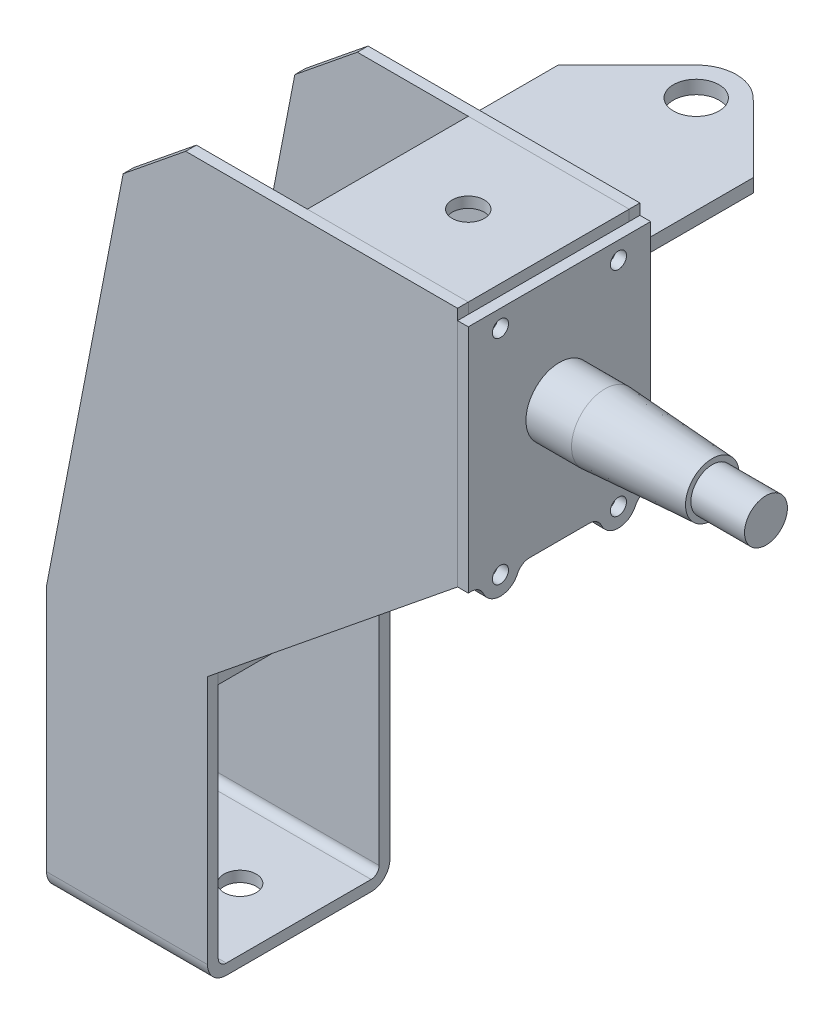
from build123d import *

# Parameters (mm, degrees)
BOSS_EXTRUDE2_DEPTH  = 107
CUT_EXTRUDE1_DEPTH   = 214
SKETCH5_W            = 60
SKETCH5_H            = 4
BOSS_EXTRUDE3_DEPTH  = 60
SKETCH6_W            = 60
SKETCH6_H            = 4
BOSS_EXTRUDE4_DEPTH  = 60
SKETCH7_R            = 3
BOSS_EXTRUDE5_DEPTH  = 4
SKETCH8_W            = 72.723840611
SKETCH8_H            = 5
BOSS_EXTRUDE6_DEPTH  = 100
CHAMFER1_SIZE        = 25
CHAMFER2_SIZE        = 25
SKETCH9_R            = 15
BOSS_EXTRUDE7_DEPTH  = 5
SKETCH10_R           = 12.25
CUT_EXTRUDE2_DEPTH   = 4
CUT_EXTRUDE5_DEPTH   = 8
SKETCH13_R           = 6
CUT_EXTRUDE6_DEPTH   = 10
SKETCH15_R           = 15
BOSS_EXTRUDE8_DEPTH  = 10
SKETCH16_R           = 12.25
BOSS_EXTRUDE9_DEPTH  = 10
SKETCH17_R           = 12.5
BOSS_EXTRUDE10_DEPTH = 77
SKETCH18_R           = 12.5
SKETCH18_R_2         = 8
CUT_EXTRUDE7_DEPTH   = 20
CHAMFER3_SIZE        = 40
CHAMFER3_SIZE2       = 2.5
SKETCH19_R           = 8.5
CUT_EXTRUDE8_DEPTH   = 20


with BuildPart() as part:
    # Sketch3 → Boss-Extrude2 (new, symmetric)
    with BuildSketch(Plane(origin=(0, 0, 0), x_dir=(0, 0, -1), z_dir=(1, 0, 0))):
        with BuildLine():
            Line((93.112387021, -93), (93.112387021, 165.555555556))
            Line((93.112387021, 165.555555556), (89.112387021, 165.555555556))
            Line((89.112387021, 165.555555556), (89.112387021, -93))
            ThreePointArc((89.112387021, -93), (88.233707365, -95.121320344), (86.112387021, -96))
            Line((86.112387021, -96), (32.112387021, -96))
            ThreePointArc((32.112387021, -96), (29.991066678, -95.121320344), (29.112387021, -93))
            Line((29.112387021, -93), (29.112387021, 165.555555556))
            Line((29.112387021, 165.555555556), (25.112387021, 165.555555556))
            Line((25.112387021, 165.555555556), (25.112387021, -93))
            ThreePointArc((25.112387021, -93), (27.162639553, -97.949747468), (32.112387021, -100))
            Line((32.112387021, -100), (86.112387021, -100))
            ThreePointArc((86.112387021, -100), (91.06213449, -97.949747468), (93.112387021, -93))
        make_face()
    extrude(amount=BOSS_EXTRUDE2_DEPTH, both=True)

    # Sketch4 → Cut-Extrude1 (cut)
    with BuildSketch(Plane.XY):
        Polygon((-190, 11.896699378), (-190, -230), (130, -230), (130, -61.975068301), (223.227453171, 13.580487255), (223.227453171, 295.555555556), (-54.204269584, 295.555555556), (-150.061773181, 217.868493514), align=None)
        Polygon((-60, -0.59060332), (-60, -100), (0, -100), (0, 0), (93.227453171, 75.555555556), (93.227453171, 165.555555556), (-8.139740481, 165.555555556), (-31.446603774, 146.666666667), align=None, mode=Mode.SUBTRACT)
    extrude(amount=-CUT_EXTRUDE1_DEPTH, mode=Mode.SUBTRACT)

    # Sketch13 → Cut-Extrude6 (cut)
    with BuildSketch(Plane.XZ.offset(100)):
        with Locations(Location((-23.160596036, -60.439663785, 0), (0, 0, 270))):
            Circle(SKETCH13_R)
    extrude(amount=-CUT_EXTRUDE6_DEPTH, mode=Mode.SUBTRACT)


with BuildPart() as body_2:
    # Sketch5 → Boss-Extrude3 (new body)
    with BuildSketch(Plane(origin=(0, 0, 0), x_dir=(0, 0, -1), z_dir=(1, 0, 0))):
        with Locations((59.112387021, -2.59060332)):
            Rectangle(SKETCH5_W, SKETCH5_H)
    extrude(amount=-BOSS_EXTRUDE3_DEPTH)


with BuildPart() as body_3:
    # Sketch6 → Boss-Extrude4 (new body)
    with BuildSketch(Plane(origin=(93.227453171, 0, 0), x_dir=(0, 0, -1), z_dir=(1, 0, 0))):
        with Locations((59.112387021, 163.555555556)):
            Rectangle(SKETCH6_W, SKETCH6_H)
    extrude(amount=-BOSS_EXTRUDE4_DEPTH)

    # Sketch12 → Cut-Extrude5 (cut)
    with BuildSketch(Plane(origin=(0, 165.555555556, 0), x_dir=(1, 0, 0), z_dir=(0, 1, 0))):
        with BuildLine():
            ThreePointArc((69.227453171, 59.112387021), (65.523553765, 64.655664216), (58.984812484, 63.355027708))
            Line((58.984812484, 63.355027708), (67.470093858, 54.869746334))
            ThreePointArc((67.470093858, 54.869746334), (68.770730366, 56.816286427), (69.227453171, 59.112387021))
        make_face()
        with BuildLine():
            Line((67.470093858, 54.869746334), (58.984812484, 63.355027708))
            ThreePointArc((58.984812484, 63.355027708), (58.984812484, 54.869746334), (67.470093858, 54.869746334))
        make_face()
    extrude(amount=-CUT_EXTRUDE5_DEPTH, mode=Mode.SUBTRACT)


with BuildPart() as body_4:
    # Sketch7 → Boss-Extrude5 (new body)
    with BuildSketch(Plane(origin=(93.227453171, 0, 0), x_dir=(0, 0, -1), z_dir=(1, 0, 0))):
        with BuildLine():
            Line((25.112387021, 161.555555556), (93.112387021, 161.555555556))
            Line((93.112387021, 161.555555556), (93.112387021, 75.555555556))
            Line((93.112387021, 75.555555556), (92.021099136, 75.555555556))
            ThreePointArc((92.021099136, 75.555555556), (89.320790512, 74.763682613), (87.475802422, 72.638888889))
            ThreePointArc((87.475802422, 72.638888889), (81.112387021, 68.555555556), (74.748971621, 72.638888889))
            ThreePointArc((74.748971621, 72.638888889), (72.903983531, 74.763682613), (70.203674907, 75.555555556))
            Line((70.203674907, 75.555555556), (48.021099136, 75.555555556))
            ThreePointArc((48.021099136, 75.555555556), (45.320790512, 74.763682613), (43.475802422, 72.638888889))
            ThreePointArc((43.475802422, 72.638888889), (37.112387021, 68.555555556), (30.748971621, 72.638888889))
            ThreePointArc((30.748971621, 72.638888889), (28.903983531, 74.763682613), (26.203674907, 75.555555556))
            Line((26.203674907, 75.555555556), (25.112387021, 75.555555556))
            Line((25.112387021, 75.555555556), (25.112387021, 161.555555556))
        make_face()
        with Locations((37.112387021, 155.082134103)):
            Circle(SKETCH7_R, mode=Mode.SUBTRACT)
        with Locations((81.112387021, 155.082134103)):
            Circle(SKETCH7_R, mode=Mode.SUBTRACT)
        with Locations((37.112387021, 75.555555556)):
            Circle(SKETCH7_R, mode=Mode.SUBTRACT)
        with Locations((81.112387021, 75.555555556)):
            Circle(SKETCH7_R, mode=Mode.SUBTRACT)
    extrude(amount=BOSS_EXTRUDE5_DEPTH)

    # Sketch10 → Cut-Extrude2 (cut)
    with BuildSketch(Plane(origin=(97.227453171, 0, 0), x_dir=(0, 0, -1), z_dir=(1, 0, 0))):
        with Locations((59.112387021, 120.555555556)):
            Circle(SKETCH10_R)
    extrude(amount=-CUT_EXTRUDE2_DEPTH, mode=Mode.SUBTRACT)


with BuildPart() as body_5:
    # Sketch8 → Boss-Extrude6 (new body)
    with BuildSketch(Plane(origin=(0, 0, -93.112387021), x_dir=(-1, 0, 0), z_dir=(0, 0, -1))):
        with Locations((-24.25985796, 117.5)):
            Rectangle(SKETCH8_W, SKETCH8_H)
    extrude(amount=BOSS_EXTRUDE6_DEPTH)

    # Chamfer1
    chamfer1_edges = [body_5.edges().sort_by_distance(p)[0] for p in [
        (-12.102062346, 117.5, -193.112387021),
    ]]
    chamfer(chamfer1_edges, length=CHAMFER1_SIZE)

    # Chamfer2
    chamfer2_edges = [body_5.edges().sort_by_distance(p)[0] for p in [
        (60.621778265, 117.5, -193.112387021),
    ]]
    chamfer(chamfer2_edges, length=CHAMFER2_SIZE)

    # Sketch9 → Boss-Extrude7 (add)
    with BuildSketch(Plane.XZ.offset(-115)):
        with Locations((24.221778265, -183.112387021)):
            Circle(SKETCH9_R)
    extrude(amount=-BOSS_EXTRUDE7_DEPTH)

    # Sketch19 → Cut-Extrude8 (cut)
    with BuildSketch(Plane.XZ.offset(-115)):
        with Locations((24.221778265, -183.112387021)):
            Circle(SKETCH19_R)
    extrude(amount=-CUT_EXTRUDE8_DEPTH, mode=Mode.SUBTRACT)


with BuildPart() as body_6:
    # Sketch15 → Boss-Extrude8 (new body)
    with BuildSketch(Plane.ZY.offset(-93.227453171)):
        with Locations((-59.112387021, 120.555555556)):
            Circle(SKETCH15_R)
    extrude(amount=BOSS_EXTRUDE8_DEPTH)


with BuildPart() as body_7:
    # Sketch16 → Boss-Extrude9 (new body)
    with BuildSketch(Plane(origin=(97.227453171, 0, 0), x_dir=(0, 0, -1), z_dir=(1, 0, 0))):
        with Locations((59.112387021, 120.555555556)):
            Circle(SKETCH16_R)
    extrude(amount=-BOSS_EXTRUDE9_DEPTH)


with BuildPart() as body_8:
    # Sketch17 → Boss-Extrude10 (new body)
    with BuildSketch(Plane(origin=(97.227453171, 0, 0), x_dir=(0, 0, -1), z_dir=(1, 0, 0))):
        with Locations((59.112387021, 120.555555556)):
            Circle(SKETCH17_R)
    extrude(amount=BOSS_EXTRUDE10_DEPTH)

    # Sketch18 → Cut-Extrude7 (cut)
    with BuildSketch(Plane(origin=(174.227453171, 0, 0), x_dir=(0, 0, -1), z_dir=(1, 0, 0))):
        with Locations((59.112387021, 120.555555556)):
            Circle(SKETCH18_R)
        with Locations((59.112387021, 120.555555556)):
            Circle(SKETCH18_R_2, mode=Mode.SUBTRACT)
    extrude(amount=-CUT_EXTRUDE7_DEPTH, mode=Mode.SUBTRACT)

    # Chamfer3
    chamfer3_edges = [body_8.edges().sort_by_distance(p)[0] for p in [
        (154.227453171, 120.555555556, -46.612387021),
    ]]
    chamfer3_side = [body_8.faces().sort_by_distance(p)[0] for p in [
        (125.727453171, 120.555555556, -46.612387021),
    ]]
    chamfer(chamfer3_edges, length=CHAMFER3_SIZE, length2=CHAMFER3_SIZE2, reference=chamfer3_side[0])

    # Combine1: union body 7, body 6
    add(body_7.part)
    add(body_6.part)


solid = Compound([part.part, body_2.part, body_3.part, body_4.part, body_5.part, body_8.part])
